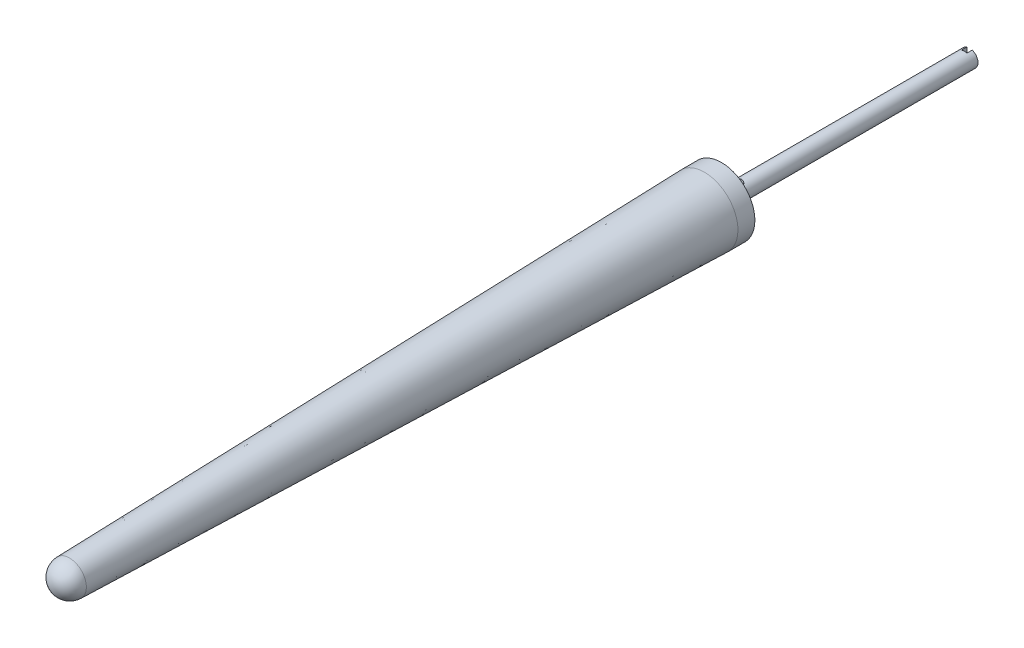
from build123d import *

# Parameters (mm, degrees)
CUT_EXTRUDE1_START = -1.62
CUT_EXTRUDE1_DEPTH = 1.62
SKETCH3_R          = 1.5
CUT_EXTRUDE2_DEPTH = 2


with BuildPart() as part:
    # Sketch1 → Revolve2 (revolve)
    with BuildSketch(Plane(origin=(0, 0, 0), x_dir=(0, 0, -1), z_dir=(1, 0, 0))):
        with BuildLine():
            Line((0, 0), (0, 2.555))
            Line((0, 2.555), (-74.8, 2.555))
            Line((-74.8, 2.555), (-74.8, 10.07))
            Line((-74.8, 10.07), (-79.91, 10.07))
            Line((-79.91, 10.07), (-271.422345798, 5.108285876))
            ThreePointArc((-271.422345798, 5.108285876), (-274.949807852, 3.566217392), (-276.4, 0))
            Line((-276.4, 0), (0, 0))
        make_face()
    revolve(axis=Axis((0, 0, 0), (0, 0, 1)))

    # Sketch2 → Cut-Extrude1 (cut)
    with BuildSketch(Plane(origin=(0, 0, 0), x_dir=(-1, 0, 0), z_dir=(0, 0, -1)).offset(CUT_EXTRUDE1_START)):
        with BuildLine():
            Line((0.81, -2.423205522), (0.81, 2.423205522))
            ThreePointArc((0.81, 2.423205522), (0, 2.555), (-0.81, 2.423205522))
            Line((-0.81, 2.423205522), (-0.81, -2.423205522))
            ThreePointArc((-0.81, -2.423205522), (0, -2.555), (0.81, -2.423205522))
        make_face()
    extrude(amount=CUT_EXTRUDE1_DEPTH, mode=Mode.SUBTRACT)

    # Sketch3 → Cut-Extrude2 (cut)
    with BuildSketch(Plane(origin=(0, 2.555, 0), x_dir=(1, 0, 0), z_dir=(0, 1, 0))):
        with Locations(Location((0, -70.175, 0), (0, 0, 270))):
            Circle(SKETCH3_R)
    extrude(amount=-CUT_EXTRUDE2_DEPTH, mode=Mode.SUBTRACT)


solid = part.part
